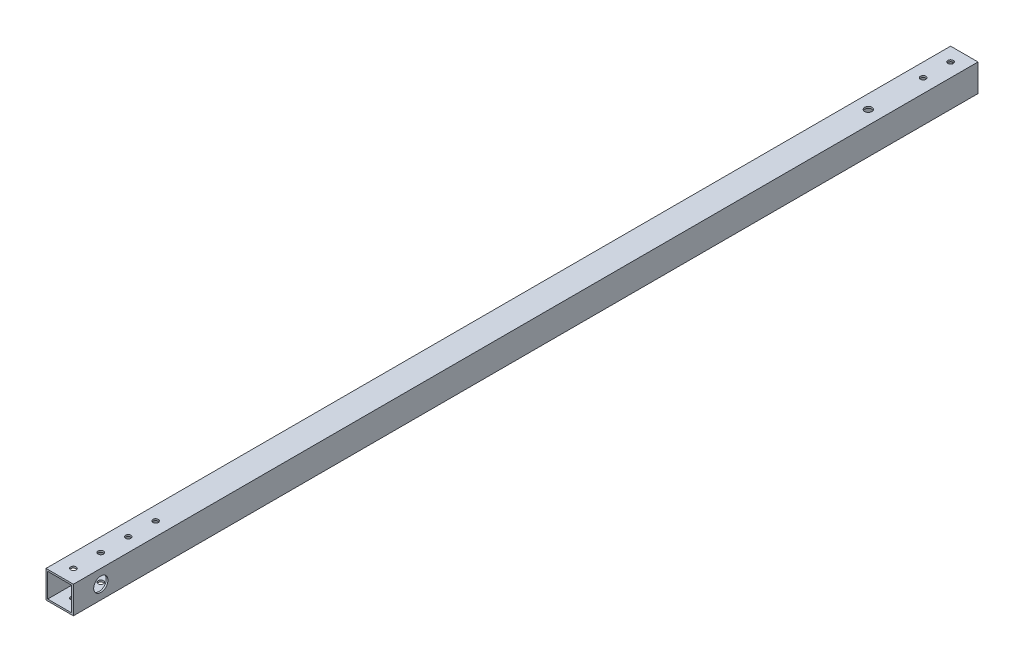
from build123d import *

# Parameters (mm, degrees)
SKETCH1_W               = 25.4
SKETCH1_H               = 25.4
SKETCH1_W_2             = 22.225
SKETCH1_H_2             = 22.225
BOSS_EXTRUDE1_DEPTH     = 838.2
SKETCH3_R               = 2.54
SKETCH3_R_2             = 3.429
CUT_EXTRUDE2_DEPTH      = 839.969343898
CUT_EXTRUDE3_DEPTH      = 839.969343898
CUT_EXTRUDE3_DEPTH_BACK = 839.969343898
SKETCH4_R               = 6.604


with BuildPart() as part:
    # Sketch1 → Boss-Extrude1 (new body)
    with BuildSketch(Plane.XY):
        with Locations((12.7, 12.7)):
            Rectangle(SKETCH1_W, SKETCH1_H)
        with Locations((12.7, 12.7)):
            Rectangle(SKETCH1_W_2, SKETCH1_H_2, mode=Mode.SUBTRACT)
    extrude(amount=BOSS_EXTRUDE1_DEPTH)

    # Sketch3 → Cut-Extrude2 (cut, through all)
    with BuildSketch(Plane(origin=(0, 25.4, 0), x_dir=(1, 0, 0), z_dir=(0, 1, 0))):
        with Locations(Location((12.7, -12.7, 0), (0, 0, 270))):
            Circle(SKETCH3_R)
        with Locations(Location((12.7, -825.5, 0), (0, 0, 270))):
            Circle(SKETCH3_R)
        with Locations(Location((12.7, -38.1, 0), (0, 0, 270))):
            Circle(SKETCH3_R)
        with Locations(Location((12.7, -88.9, 0), (0, 0, 270))):
            Circle(SKETCH3_R_2)
        with Locations(Location((12.7, -800.1, 0), (0, 0, 270))):
            Circle(SKETCH3_R)
        with Locations(Location((12.7, -774.7, 0), (0, 0, 270))):
            Circle(SKETCH3_R)
        with Locations(Location((12.7, -749.3, 0), (0, 0, 270))):
            Circle(SKETCH3_R)
    extrude(amount=-CUT_EXTRUDE2_DEPTH, mode=Mode.SUBTRACT)

    # Sketch4 → Cut-Extrude3 (cut, two sides: drawn at the far end of the back side and taken through both)
    with BuildSketch(Plane(origin=(25.4, 0, 0), x_dir=(0, 0, -1), z_dir=(1, 0, 0)).offset(-CUT_EXTRUDE3_DEPTH_BACK)):
        with Locations(Location((-812.8, 12.7, 0), (0, 0, 180))):
            Circle(SKETCH4_R)
    extrude(amount=CUT_EXTRUDE3_DEPTH + CUT_EXTRUDE3_DEPTH_BACK, mode=Mode.SUBTRACT)


solid = part.part
